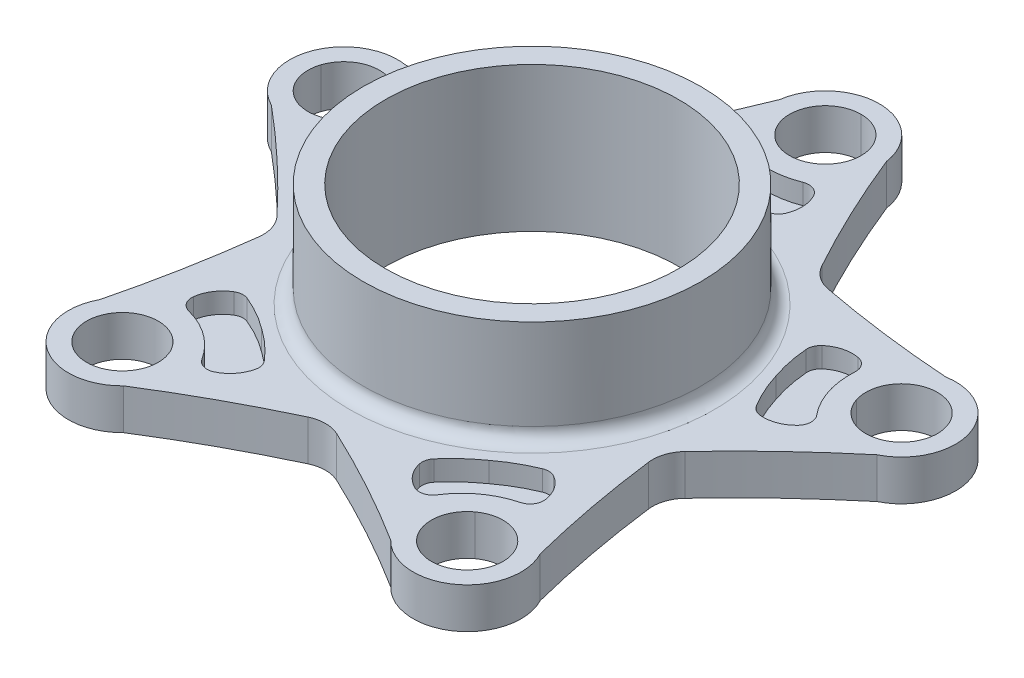
from build123d import *

# Parameters (mm, degrees)
SKETCH1_R                 = 31.75
CENTERCIRCLEEXTRUDE_DEPTH = 19.558
SKETCH2_R                 = 80.01
BASEEXPAND_DEPTH          = 7.62
SKETCH3_R                 = 27.559
CENTERCUT_DEPTH           = 27.178
SKETCH4_R                 = 6.731
OUTERCIRCLECUT_DEPTH      = 7.62
SKETCH8_R                 = 80.01
STARFISHCUT_DEPTH         = 7.62
BATMAN_CUT_DEPTH          = 3.81
FILLET11_R                = 2.54
FILLET12_R                = 6.35
FILLET13_R                = 2.54


with BuildPart() as part:
    # Sketch1 → CenterCircleExtrude (new body)
    with BuildSketch(Plane(origin=(0, 0, 0), x_dir=(1, 0, 0), z_dir=(0, 1, 0))):
        Circle(SKETCH1_R)
    extrude(amount=CENTERCIRCLEEXTRUDE_DEPTH)

    # Sketch2 → BaseExpand (add)
    with BuildSketch(Plane.XZ):
        Circle(SKETCH2_R)
    extrude(amount=BASEEXPAND_DEPTH)

    # Sketch3 → CenterCut (cut)
    with BuildSketch(Plane(origin=(0, 19.558, 0), x_dir=(1, 0, 0), z_dir=(0, 1, 0))):
        Circle(SKETCH3_R)
    extrude(amount=-CENTERCUT_DEPTH, mode=Mode.SUBTRACT)

    # Sketch4 → OuterCircleCut (cut)
    with BuildSketch(Plane(origin=(0, 0, 0), x_dir=(1, 0, 0), z_dir=(0, 1, 0))):
        with Locations((0, 55.118)):
            Circle(SKETCH4_R)
        with Locations((52.420333065, 17.032398696)):
            Circle(SKETCH4_R)
        with Locations((32.397547536, -44.591398696)):
            Circle(SKETCH4_R)
        with Locations((-32.397547536, -44.591398696)):
            Circle(SKETCH4_R)
        with Locations((-52.420333065, 17.032398696)):
            Circle(SKETCH4_R)
    extrude(amount=-OUTERCIRCLECUT_DEPTH, mode=Mode.SUBTRACT)

    # Sketch8 → StarfishCut (cut)
    with BuildSketch(Plane(origin=(0, 0, 0), x_dir=(1, 0, 0), z_dir=(0, 1, 0))):
        Circle(SKETCH8_R)
        with BuildLine():
            ThreePointArc((-60.451485692, 10.809361858), (-62.083067271, 20.172011359), (-55.259862746, 26.787534327))
            ThreePointArc((-55.259862746, 26.787534327), (-52.990125634, 27.176408575), (-50.691117004, 27.044162367))
            ThreePointArc((-50.691117004, 27.044162367), (-36.498445494, 28.482280038), (-22.436174146, 30.88074446))
            ThreePointArc((-22.436174146, 30.88074446), (-15.809618103, 43.513592992), (-10.056110229, 56.567222915))
            ThreePointArc((-10.056110229, 56.567222915), (-9.47145111, 58.794576379), (-8.400222382, 60.833055899))
            ThreePointArc((-8.400222382, 60.833055899), (0, 65.278), (8.400222382, 60.833055899))
            ThreePointArc((8.400222382, 60.833055899), (9.47145111, 58.794576379), (10.056110229, 56.567222915))
            ThreePointArc((10.056110229, 56.567222915), (15.809618103, 43.513592992), (22.436174146, 30.88074446))
            ThreePointArc((22.436174146, 30.88074446), (36.498445494, 28.482280038), (50.691117004, 27.044162367))
            ThreePointArc((50.691117004, 27.044162367), (52.990125634, 27.176408575), (55.259862746, 26.787534327))
            ThreePointArc((55.259862746, 26.787534327), (60.546685924, 23.130594267), (62.580333065, 17.032398696))
            ThreePointArc((62.580333065, 17.032398696), (62.033399971, 13.743851196), (60.451485692, 10.809361858))
            ThreePointArc((60.451485692, 10.809361858), (58.843804343, 9.160637981), (56.90613492, 7.916304043))
            ThreePointArc((56.90613492, 7.916304043), (46.26932683, -1.589400596), (36.302492346, -11.795394786))
            ThreePointArc((36.302492346, -11.795394786), (38.366897955, -25.910575851), (41.384943465, -39.853011375))
            ThreePointArc((41.384943465, -39.853011375), (42.22114982, -41.998632188), (42.552695773, -44.27744921))
            ThreePointArc((42.552695773, -44.27744921), (42.556334523, -44.434405209), (42.557547536, -44.591398696))
            ThreePointArc((42.557547536, -44.591398696), (38.241722309, -52.902308467), (28.960850446, -54.152502874))
            ThreePointArc((28.960850446, -54.152502874), (26.896020001, -53.132990748), (25.11381532, -51.674677951))
            ThreePointArc((25.11381532, -51.674677951), (12.786398515, -44.495896582), (0, -38.170699348))
            ThreePointArc((0, -38.170699348), (-12.786398515, -44.495896582), (-25.11381532, -51.674677951))
            ThreePointArc((-25.11381532, -51.674677951), (-26.896020001, -53.132990748), (-28.960850446, -54.152502874))
            ThreePointArc((-28.960850446, -54.152502874), (-38.369445699, -52.811011359), (-42.552695773, -44.27744921))
            ThreePointArc((-42.552695773, -44.27744921), (-42.22114982, -41.998632188), (-41.384943465, -39.853011375))
            ThreePointArc((-41.384943465, -39.853011375), (-38.366897955, -25.910575851), (-36.302492346, -11.795394786))
            ThreePointArc((-36.302492346, -11.795394786), (-46.26932683, -1.589400596), (-56.90613492, 7.916304043))
            ThreePointArc((-56.90613492, 7.916304043), (-58.843804343, 9.160637981), (-60.451485692, 10.809361858))
        make_face(mode=Mode.SUBTRACT)
    extrude(amount=-STARFISHCUT_DEPTH, mode=Mode.SUBTRACT)

    # Sketch14 → Batman Cut (cut)
    with BuildSketch(Plane(origin=(0, 0, 0), x_dir=(1, 0, 0), z_dir=(0, 1, 0))):
        with BuildLine():
            ThreePointArc((38.21208836, 3.61640796), (36.123298629, 7.295617591), (34.592844745, 11.239896606))
            ThreePointArc((34.592844745, 11.239896606), (33.51261891, 15.330463583), (33.039900139, 19.534766499))
            ThreePointArc((33.039900139, 19.534766499), (36.998616208, 21.99136873), (41.568556549, 21.08474162))
            ThreePointArc((41.568556549, 21.08474162), (42.072446101, 13.670166407), (46.022968853, 7.375470207))
            ThreePointArc((46.022968853, 7.375470207), (42.858711498, 3.955849931), (38.21208836, 3.61640796))
        make_face()
        with BuildLine():
            ThreePointArc((7.207390506, 46.049590062), (0, 44.237587757), (-7.207390506, 46.049590062))
            ThreePointArc((-7.207390506, 46.049590062), (-9.481833356, 41.983481706), (-8.368776337, 37.459387154))
            ThreePointArc((-8.368776337, 37.459387154), (-4.224168519, 36.609768371), (0, 36.373069478))
            ThreePointArc((0, 36.373069478), (4.224168519, 36.609768371), (8.368776337, 37.459387154))
            ThreePointArc((8.368776337, 37.459387154), (9.481833356, 41.983481706), (7.207390506, 46.049590062))
        make_face()
        with BuildLine():
            ThreePointArc((15.24759305, -35.224324117), (18.101257819, -32.100828731), (21.37955382, -29.426431345))
            ThreePointArc((21.37955382, -29.426431345), (24.936106057, -27.135020814), (28.788557608, -25.386237496))
            ThreePointArc((28.788557608, -25.386237496), (32.348235709, -28.392068372), (32.898171317, -33.018503097))
            ThreePointArc((32.898171317, -33.018503097), (26.00220168, -35.788960285), (21.236368508, -41.491298791))
            ThreePointArc((21.236368508, -41.491298791), (17.006307064, -39.538631994), (15.24759305, -35.224324117))
        make_face()
        with BuildLine():
            ThreePointArc((-28.788557608, -25.386237496), (-24.936106057, -27.135020814), (-21.37955382, -29.426431345))
            ThreePointArc((-21.37955382, -29.426431345), (-18.101257819, -32.100828731), (-15.24759305, -35.224324117))
            ThreePointArc((-15.24759305, -35.224324117), (-17.006307064, -39.538631994), (-21.236368508, -41.491298791))
            ThreePointArc((-21.236368508, -41.491298791), (-26.00220168, -35.788960285), (-32.898171317, -33.018503097))
            ThreePointArc((-32.898171317, -33.018503097), (-32.348235709, -28.392068372), (-28.788557608, -25.386237496))
        make_face()
        with BuildLine():
            ThreePointArc((-33.039900139, 19.534766499), (-33.51261891, 15.330463583), (-34.592844745, 11.239896606))
            ThreePointArc((-34.592844745, 11.239896606), (-36.123298629, 7.295617591), (-38.21208836, 3.61640796))
            ThreePointArc((-38.21208836, 3.61640796), (-42.858711498, 3.955849931), (-46.022968853, 7.375470207))
            ThreePointArc((-46.022968853, 7.375470207), (-42.072446101, 13.670166407), (-41.568556549, 21.08474162))
            ThreePointArc((-41.568556549, 21.08474162), (-36.998616208, 21.99136873), (-33.039900139, 19.534766499))
        make_face()
    extrude(amount=-BATMAN_CUT_DEPTH, mode=Mode.SUBTRACT)

    # Fillet11
    fillet11_edges = [part.edges().sort_by_distance(p)[0] for p in [
        (21.236368508, -1.905, 41.491298791),
        (32.898171317, -1.905, 33.018503097),
        (28.788557608, -1.905, 25.386237496),
        (15.24759305, -1.905, 35.224324117),
        (-21.236368508, -1.905, 41.491298791),
        (-32.898171317, -1.905, 33.018503097),
        (-15.24759305, -1.905, 35.224324117),
        (-28.788557608, -1.905, 25.386237496),
        (-38.21208836, -1.905, -3.61640796),
        (-46.022968853, -1.905, -7.375470207),
        (-33.039900139, -1.905, -19.534766499),
        (-41.568556549, -1.905, -21.08474162),
        (38.21208836, -1.905, -3.61640796),
        (33.039900139, -1.905, -19.534766499),
        (46.022968853, -1.905, -7.375470207),
        (41.568556549, -1.905, -21.08474162),
        (-8.368776337, -1.905, -37.459387154),
        (8.368776337, -1.905, -37.459387154),
        (-7.207390506, -1.905, -46.049590062),
        (7.207390506, -1.905, -46.049590062),
    ]]
    fillet(fillet11_edges, radius=FILLET11_R)

    # Fillet12
    fillet12_edges = [part.edges().sort_by_distance(p)[0] for p in [
        (-36.302492346, -3.81, 11.795394786),
        (0, -3.81, 38.170699348),
        (36.302492346, -3.81, 11.795394786),
        (22.436174146, -3.81, -30.88074446),
        (-22.436174146, -3.81, -30.88074446),
    ]]
    fillet(fillet12_edges, radius=FILLET12_R)

    # Fillet13
    fillet13_edges = [part.edges().sort_by_distance(p)[0] for p in [
        (-31.75, 0, 0),
    ]]
    fillet(fillet13_edges, radius=FILLET13_R)


solid = part.part
